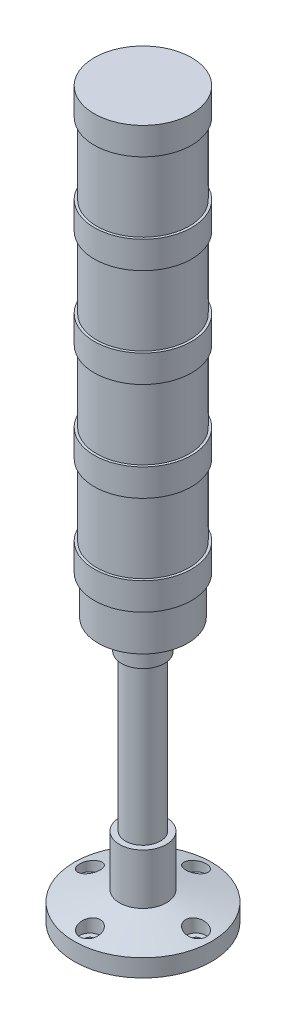
from build123d import *

# Parameters (mm, degrees)
SKETCH1_R           = 35.25
BOSS_EXTRUDE1_DEPTH = 9
SKETCH3_R           = 12
BOSS_EXTRUDE2_DEPTH = 26
SKETCH4_R           = 9
BOSS_EXTRUDE3_DEPTH = 80
SKETCH5_R           = 11
BOSS_EXTRUDE4_DEPTH = 10
SKETCH7_R           = 23
BOSS_EXTRUDE5_DEPTH = 20
SKETCH9_R           = 2.65
CUT_EXTRUDE1_DEPTH  = 20
CUT_EXTRUDE2_START  = 45
SKETCH11_R          = 5.25
CUT_EXTRUDE2_DEPTH  = 40


with BuildPart() as part:
    # Sketch1 → Boss-Extrude1 (new body)
    with BuildSketch(Plane(origin=(0, 0, 0), x_dir=(1, 0, 0), z_dir=(0, 1, 0))):
        with Locations(Location((0, 0, 0), (0, 0, 270))):
            Circle(SKETCH1_R)
    extrude(amount=BOSS_EXTRUDE1_DEPTH)

    # Sketch2 → Revolve1 (revolve)
    with BuildSketch(Plane.XY, mode=Mode.PRIVATE) as revolve1_sk:
        Polygon((0, 9), (0, 14.5), (12, 14.5), (35.25, 9), align=None)
    revolve(revolve1_sk.sketch.rotate(Axis((0, 9, 0), (0, 1, 0)), 90), axis=Axis((0, 9, 0), (0, 1, 0)))

    # Sketch3 → Boss-Extrude2 (add)
    with BuildSketch(Plane(origin=(0, 14.5, 0), x_dir=(1, 0, 0), z_dir=(0, 1, 0))):
        with Locations(Location((0, 0, 0), (0, 0, 90))):
            Circle(SKETCH3_R)
    extrude(amount=BOSS_EXTRUDE2_DEPTH)

    # Sketch4 → Boss-Extrude3 (add)
    with BuildSketch(Plane(origin=(0, 40.5, 0), x_dir=(1, 0, 0), z_dir=(0, 1, 0))):
        with Locations(Location((0, 0, 0), (0, 0, 270))):
            Circle(SKETCH4_R)
    extrude(amount=BOSS_EXTRUDE3_DEPTH)

    # Sketch5 → Boss-Extrude4 (add)
    with BuildSketch(Plane(origin=(0, 120.5, 0), x_dir=(1, 0, 0), z_dir=(0, 1, 0))):
        with Locations(Location((0, 0, 0), (0, 0, 270))):
            Circle(SKETCH5_R)
    extrude(amount=BOSS_EXTRUDE4_DEPTH)

    # Sketch6 → Revolve2 (revolve)
    with BuildSketch(Plane.XY, mode=Mode.PRIVATE) as revolve2_sk:
        Polygon((0, 130.5), (0, 135.5), (23, 135.5), (11, 130.5), align=None)
    revolve(revolve2_sk.sketch.rotate(Axis((0, 130.5, 0), (0, 1, 0)), 270), axis=Axis((0, 130.5, 0), (0, 1, 0)))

    # Sketch7 → Boss-Extrude5 (add)
    with BuildSketch(Plane(origin=(0, 135.5, 0), x_dir=(1, 0, 0), z_dir=(0, 1, 0))):
        with Locations(Location((0, 0, 0), (0, 0, 270))):
            Circle(SKETCH7_R)
    extrude(amount=BOSS_EXTRUDE5_DEPTH)

    # Sketch8 → Revolve6 (revolve)
    with BuildSketch(Plane.XY, mode=Mode.PRIVATE) as revolve6_sk:
        Polygon((-25, 155.5), (0, 155.5), (0, 372.060698134), (-25, 372.060698134), (-25, 358.060698134), (-23.75, 358.060698134), (-23.75, 321.420523601), (-25, 321.420523601), (-25, 307.420523601), (-23.75, 307.420523601), (-23.75, 270.780349067), (-25, 270.780349067), (-25, 256.780349067), (-23.75, 256.780349067), (-23.75, 220.140174534), (-25, 220.140174534), (-25, 206.140174534), (-23.75, 206.140174534), (-23.75, 169.5), (-25, 169.5), align=None)
    revolve(revolve6_sk.sketch.rotate(Axis((0, 155.5, 0), (0, 1, 0)), 270), axis=Axis((0, 155.5, 0), (0, 1, 0)))

    # Sketch9 → Cut-Extrude1 (cut)
    with BuildSketch(Plane.XZ):
        with Locations(Location((0, 27.25, 0), (0, 0, 270))):
            Circle(SKETCH9_R)
        with Locations(Location((27.25, 0, 0), (0, 0, 270))):
            Circle(SKETCH9_R)
        with Locations(Location((0, -27.25, 0), (0, 0, 270))):
            Circle(SKETCH9_R)
        with Locations(Location((-27.25, 0, 0), (0, 0, 270))):
            Circle(SKETCH9_R)
    extrude(amount=-CUT_EXTRUDE1_DEPTH, mode=Mode.SUBTRACT)

    # Sketch11 → Cut-Extrude2 (cut)
    with BuildSketch(Plane(origin=(0, 0, 0), x_dir=(1, 0, 0), z_dir=(0, 1, 0)).offset(CUT_EXTRUDE2_START)):
        with Locations(Location((0, 27.25, 0), (0, 0, 270))):
            Circle(SKETCH11_R)
        with Locations(Location((27.25, 0, 0), (0, 0, 270))):
            Circle(SKETCH11_R)
        with Locations(Location((0, -27.25, 0), (0, 0, 270))):
            Circle(SKETCH11_R)
        with Locations(Location((-27.25, 0, 0), (0, 0, 270))):
            Circle(SKETCH11_R)
    extrude(amount=-CUT_EXTRUDE2_DEPTH, mode=Mode.SUBTRACT)


solid = part.part
